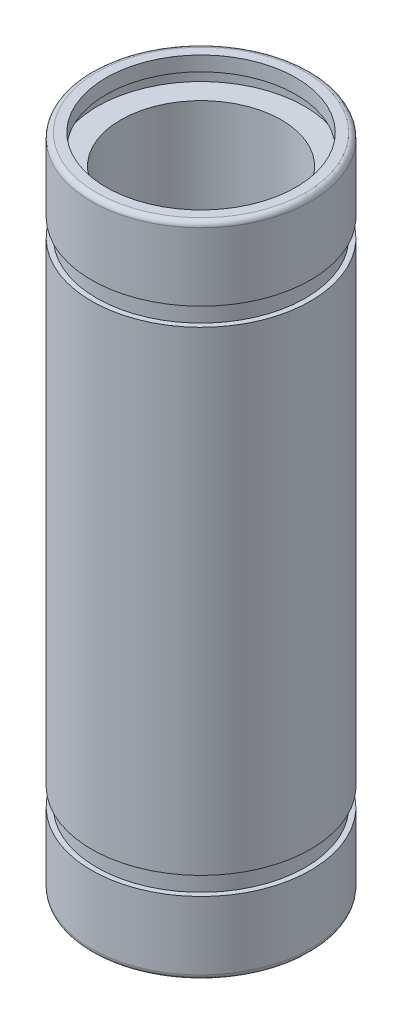
from build123d import *


with BuildPart() as part:
    # Sketch1 → Revolve1 (revolve)
    with BuildSketch(Plane(origin=(0, 0, 0), x_dir=(0, -1, 0), z_dir=(1, 0, 0))):
        with BuildLine():
            Line((-17.5, 7.5), (-22.15, 7.5))
            ThreePointArc((-22.15, 7.5), (-22.397487373, 7.397487373), (-22.5, 7.15))
            Line((-22.5, 7.15), (-22.5, 6.5))
            Line((-22.5, 6.5), (-21.5, 6.5))
            Line((-21.5, 6.5), (-21.5, 7.1))
            Line((-21.5, 7.1), (-20.5, 7.1))
            Line((-20.5, 7.1), (-20.5, 5.5))
            Line((-20.5, 5.5), (20.5, 5.5))
            Line((20.5, 5.5), (20.5, 7.1))
            Line((20.5, 7.1), (21.5, 7.1))
            Line((21.5, 7.1), (21.5, 6.5))
            Line((21.5, 6.5), (22.5, 6.5))
            Line((22.5, 6.5), (22.5, 7.15))
            ThreePointArc((22.5, 7.15), (22.397487373, 7.397487373), (22.15, 7.5))
            Line((22.15, 7.5), (17.5, 7.5))
            Line((17.5, 7.5), (17.5, 7.15))
            Line((17.5, 7.15), (16.25, 7.15))
            Line((16.25, 7.15), (16.25, 7.5))
            Line((16.25, 7.5), (-16.25, 7.5))
            Line((-16.25, 7.5), (-16.25, 7.15))
            Line((-16.25, 7.15), (-17.5, 7.15))
            Line((-17.5, 7.15), (-17.5, 7.5))
        make_face()
    revolve(axis=Axis((0, 12, 0), (0, -1, 0)))


solid = part.part
